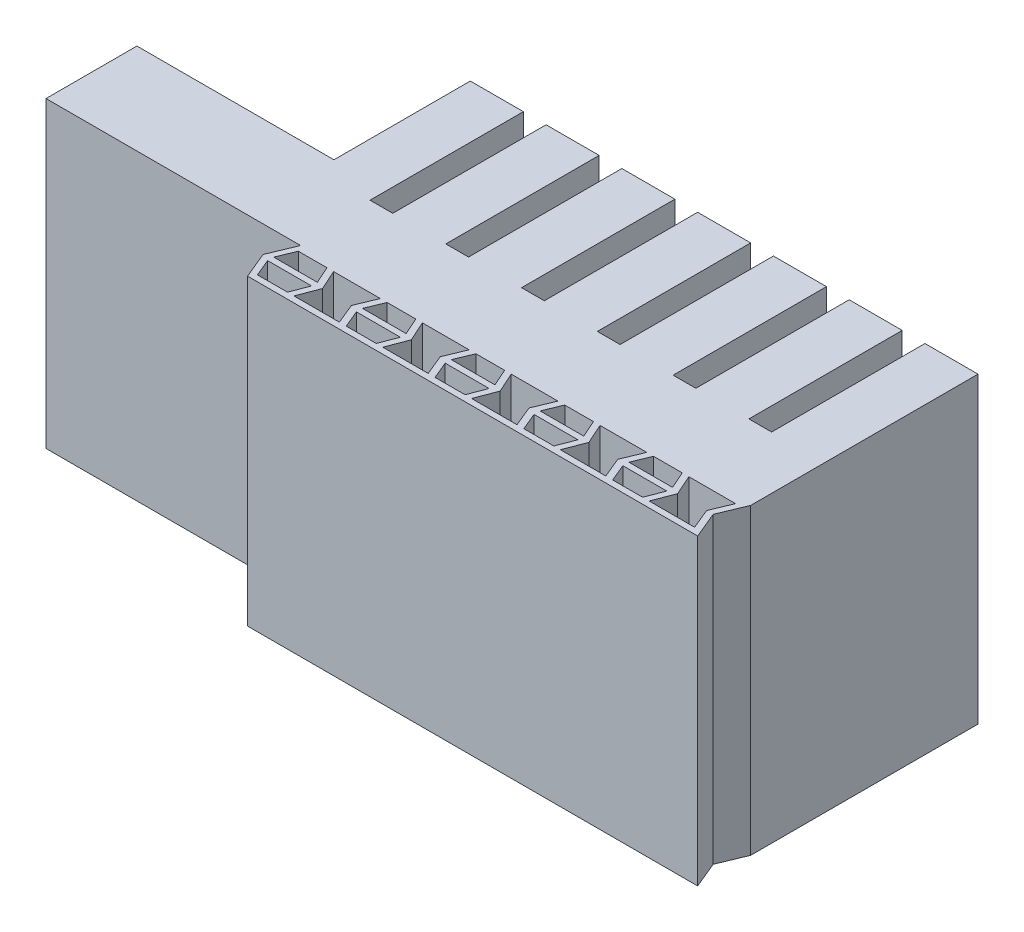
from build123d import *

# Parameters (mm, degrees)
BOSS_EXTRUDE1_DEPTH = 1.1
BOSS_EXTRUDE2_DEPTH = 17.8
BOSS_EXTRUDE3_DEPTH = 1.1
BOSS_EXTRUDE4_DEPTH = 20
LPATTERN1_COUNT     = 5
LPATTERN1_PITCH     = 5.86
BOSS_EXTRUDE5_DEPTH = 20
SKETCH7_W           = 6
SKETCH7_H           = 20
BOSS_EXTRUDE6_DEPTH = 7
SKETCH8_R           = 2.075
CUT_EXTRUDE1_DEPTH  = 14.1
SKETCH9_W           = 7.282395113
SKETCH9_H           = 2.9
BOSS_EXTRUDE7_DEPTH = 1.4


with BuildPart() as part:
    # Sketch2 → Boss-Extrude1 (new body)
    with BuildSketch(Plane(origin=(0, 0, 0), x_dir=(1, 0, 0), z_dir=(0, 1, 0))):
        Polygon((36, 15), (36, 4.881546635), (34.5, 4.881546635), (34.5, 15), (31, 15), (31, 4.881546635), (29.5, 4.881546635), (29.5, 15), (26, 15), (26, 4.881546635), (24.5, 4.881546635), (24.5, 15), (21, 15), (21, 4.881546635), (19.5, 4.881546635), (19.5, 15), (16, 15), (16, 4.881546635), (14.5, 4.881546635), (14.5, 15), (11, 15), (11, 4.881546635), (9.5, 4.881546635), (9.5, 15), (6, 15), (6, 6), (4.5, 6), (0, 6), (0, 0), (39.5, 0), (39.5, 15), align=None)
    extrude(amount=BOSS_EXTRUDE1_DEPTH)

    # Sketch3 → Boss-Extrude2 (add)
    with BuildSketch(Plane(origin=(0, 1.1, 0), x_dir=(1, 0, 0), z_dir=(0, 1, 0))):
        Polygon((6, 6), (0, 6), (0, 0), (39.5, 0), (39.5, 15), (36, 15), (36, 4.881546635), (34.5, 4.881546635), (34.5, 15), (31, 15), (31, 4.881546635), (29.5, 4.881546635), (29.5, 15), (26, 15), (26, 4.881546635), (24.5, 4.881546635), (24.5, 15), (21, 15), (21, 4.881546635), (19.5, 4.881546635), (19.5, 15), (16, 15), (16, 4.881546635), (14.5, 4.881546635), (14.5, 15), (11, 15), (11, 4.881546635), (9.5, 4.881546635), (9.5, 15), (6, 15), align=None)
        Polygon((7.1, 4.9), (7.1, 1.1), (38.4, 1.1), (38.4, 13.9), (37.1, 13.9), (37.1, 3.781546635), (33.4, 3.781546635), (33.4, 13.9), (32.1, 13.9), (32.1, 3.781546635), (28.4, 3.781546635), (28.4, 13.9), (27.1, 13.9), (27.1, 3.781546635), (23.4, 3.781546635), (23.4, 13.9), (22.1, 13.9), (22.1, 3.781546635), (18.4, 3.781546635), (18.4, 13.9), (17.1, 13.9), (17.1, 3.781546635), (13.4, 3.781546635), (13.4, 13.9), (12.1, 13.9), (12.1, 3.781546635), (8.4, 3.781546635), (8.4, 13.9), (7.1, 13.9), align=None, mode=Mode.SUBTRACT)
    extrude(amount=BOSS_EXTRUDE2_DEPTH)

    # Sketch4 → Boss-Extrude3 (add)
    with BuildSketch(Plane(origin=(0, 18.9, 0), x_dir=(1, 0, 0), z_dir=(0, 1, 0))):
        Polygon((0, 6), (0, 0), (39.5, 0), (39.5, 15), (36, 15), (36, 4.881546635), (34.5, 4.881546635), (34.5, 15), (31, 15), (31, 4.881546635), (29.5, 4.881546635), (29.5, 15), (26, 15), (26, 4.881546635), (24.5, 4.881546635), (24.5, 15), (21, 15), (21, 4.881546635), (19.5, 4.881546635), (19.5, 15), (16, 15), (16, 4.881546635), (14.5, 4.881546635), (14.5, 15), (11, 15), (11, 4.881546635), (9.5, 4.881546635), (9.5, 15), (6, 15), (6, 6), align=None)
    extrude(amount=BOSS_EXTRUDE3_DEPTH)

    # Sketch5 → Boss-Extrude4 (add)
    with BuildSketch(Plane.XZ):
        Polygon((33.440143193, 0), (39.5, 0), (38.775126266, 1.75), (39.5, 3.5), (33.440143193, 3.5), (32.715269459, 1.75), align=None)
        Polygon((33.014590612, 1.55), (35.897512895, 1.55), (35.381626855, 0.4), (34.816385288, 0.4), (33.490936209, 0.4), align=None, mode=Mode.SUBTRACT)
        Polygon((34.74142697, 3.1), (35.473359212, 3.1), (35.911102874, 1.95), (33.014590612, 1.95), (33.490936209, 3.1), align=None, mode=Mode.SUBTRACT)
        Polygon((35.820031028, 0.4), (36.420007202, 1.737451581), (35.901357695, 3.1), (38.901357695, 3.1), (38.342169386, 1.75), (38.901357695, 0.4), align=None, mode=Mode.SUBTRACT)
    boss_extrude4 = extrude(amount=-BOSS_EXTRUDE4_DEPTH)

    # LPattern1: Boss-Extrude4 ×5
    with Locations(*[(-i * LPATTERN1_PITCH, 0, 0) for i in range(1, LPATTERN1_COUNT)]):
        add(boss_extrude4)

    # Sketch6 → Boss-Extrude5 (add)
    with BuildSketch(Plane.XZ):
        Polygon((10.000143193, 3.5), (9.800143193, 3.5), (9.075269459, 1.75), (9.800143193, 0), (10.000143193, 0), (9.275269459, 1.75), align=None)
    extrude(amount=-BOSS_EXTRUDE5_DEPTH)

    # Sketch7 → Boss-Extrude6 (add)
    with BuildSketch(Plane.ZY):
        with Locations((-3, 10)):
            Rectangle(SKETCH7_W, SKETCH7_H)
    extrude(amount=BOSS_EXTRUDE6_DEPTH)

    # Sketch8 → Cut-Extrude1 (cut)
    with BuildSketch(Plane.ZY.offset(7)):
        with Locations((-3, 10)):
            Circle(SKETCH8_R)
    extrude(amount=-CUT_EXTRUDE1_DEPTH, mode=Mode.SUBTRACT)

    # Sketch9 → Boss-Extrude7 (add)
    with BuildSketch(Plane(origin=(0, 0, -6), x_dir=(-1, 0, 0), z_dir=(0, 0, -1))):
        with Locations((-2.358802444, 3.5)):
            Rectangle(SKETCH9_W, SKETCH9_H)
        with Locations((-2.358802444, 16.5)):
            Rectangle(SKETCH9_W, SKETCH9_H)
    extrude(amount=BOSS_EXTRUDE7_DEPTH)


solid = part.part
